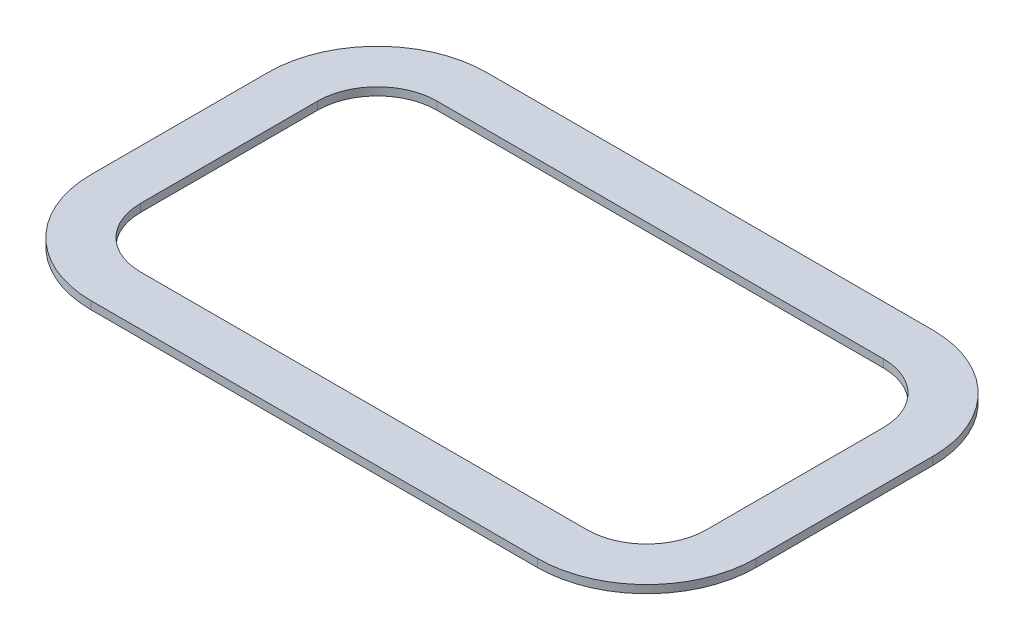
from build123d import *

# Parameters (mm, degrees)
BOSS_EXTRUDE1_DEPTH = 4


with BuildPart() as part:
    # Sketch1 → Boss-Extrude1 (new body)
    with BuildSketch(Plane(origin=(0, 0, 0), x_dir=(1, 0, 0), z_dir=(0, 1, 0))):
        with BuildLine():
            Line((0.861185256, 26.518843154), (225.891185256, 26.518843154))
            ThreePointArc((225.891185256, 26.518843154), (264.782058221, 10.409716119), (280.891185256, -28.481156846))
            Line((280.891185256, -28.481156846), (280.891185256, -117.741156846))
            ThreePointArc((280.891185256, -117.741156846), (264.782058221, -156.632029811), (225.891185256, -172.741156846))
            Line((225.891185256, -172.741156846), (0.861185256, -172.741156846))
            ThreePointArc((0.861185256, -172.741156846), (-38.029687709, -156.632029811), (-54.138814744, -117.741156846))
            Line((-54.138814744, -117.741156846), (-54.138814744, -28.481156846))
            ThreePointArc((-54.138814744, -28.481156846), (-38.029687709, 10.409716119), (0.861185256, 26.518843154))
        make_face()
        with BuildLine():
            Line((0.861185256, 1.518843154), (225.891185256, 1.518843154))
            ThreePointArc((225.891185256, 1.518843154), (247.104388692, -7.26795341), (255.891185256, -28.481156846))
            Line((255.891185256, -28.481156846), (255.891185256, -117.741156846))
            ThreePointArc((255.891185256, -117.741156846), (247.104388692, -138.954360281), (225.891185256, -147.741156846))
            Line((225.891185256, -147.741156846), (0.861185256, -147.741156846))
            ThreePointArc((0.861185256, -147.741156846), (-20.352018179, -138.954360281), (-29.138814744, -117.741156846))
            Line((-29.138814744, -117.741156846), (-29.138814744, -28.481156846))
            ThreePointArc((-29.138814744, -28.481156846), (-20.352018179, -7.26795341), (0.861185256, 1.518843154))
        make_face(mode=Mode.SUBTRACT)
    extrude(amount=BOSS_EXTRUDE1_DEPTH)


solid = part.part
